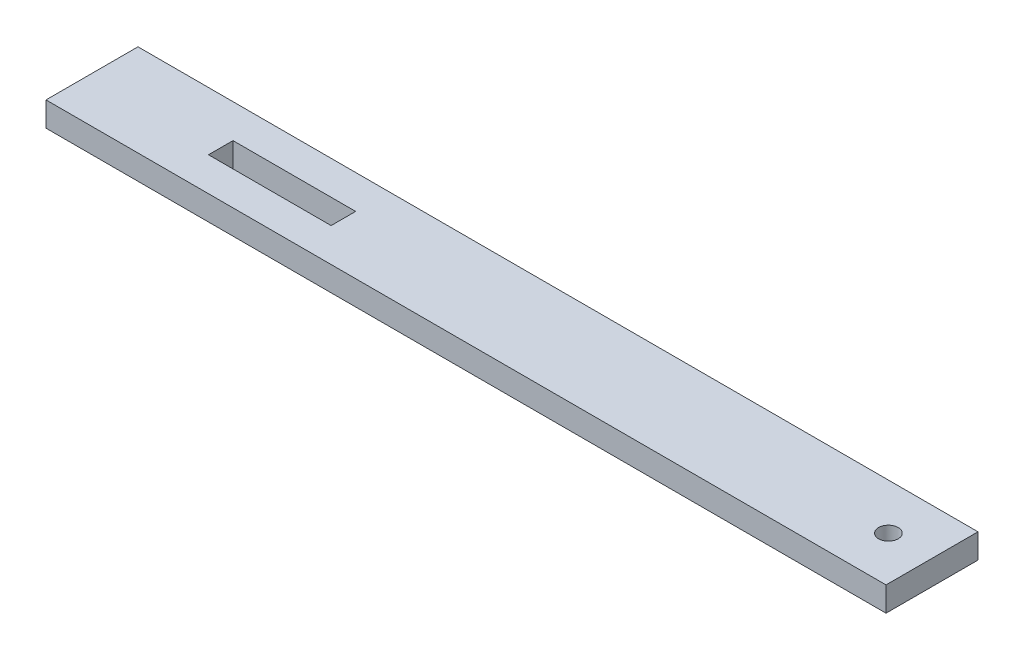
from build123d import *

# Parameters (mm, degrees)
SKETCH1_W           = 78.74
SKETCH1_H           = 19.05
BOSS_EXTRUDE1_DEPTH = 5.08
SKETCH2_W           = 25.4
SKETCH2_H           = 5.08
CUT_EXTRUDE1_DEPTH  = 41.823142028
SKETCH3_W           = 19.05
SKETCH3_H           = 5.08
BOSS_EXTRUDE2_DEPTH = 95.25
SKETCH4_R           = 2.032
CUT_EXTRUDE2_DEPTH  = 5.08


with BuildPart() as part:
    # Sketch1 → Boss-Extrude1 (new body)
    with BuildSketch(Plane(origin=(0, 0, 0), x_dir=(1, 0, 0), z_dir=(0, 1, 0))):
        Rectangle(SKETCH1_W, SKETCH1_H)
    extrude(amount=BOSS_EXTRUDE1_DEPTH)

    # Sketch2 → Cut-Extrude1 (cut, through all)
    with BuildSketch(Plane(origin=(0, 5.08, 0), x_dir=(1, 0, 0), z_dir=(0, 1, 0))):
        Rectangle(SKETCH2_W, SKETCH2_H)
    extrude(amount=-CUT_EXTRUDE1_DEPTH, mode=Mode.SUBTRACT)

    # Sketch3 → Boss-Extrude2 (add)
    with BuildSketch(Plane(origin=(39.37, 0, 0), x_dir=(0, 0, -1), z_dir=(1, 0, 0))):
        with Locations((0, 2.54)):
            Rectangle(SKETCH3_W, SKETCH3_H)
    extrude(amount=BOSS_EXTRUDE2_DEPTH)

    # Sketch4 → Cut-Extrude2 (cut)
    with BuildSketch(Plane.XZ):
        with Locations(Location((125.585488771, 0, 0), (0, 0, 270))):
            Circle(SKETCH4_R)
    extrude(amount=-CUT_EXTRUDE2_DEPTH, mode=Mode.SUBTRACT)


solid = part.part
